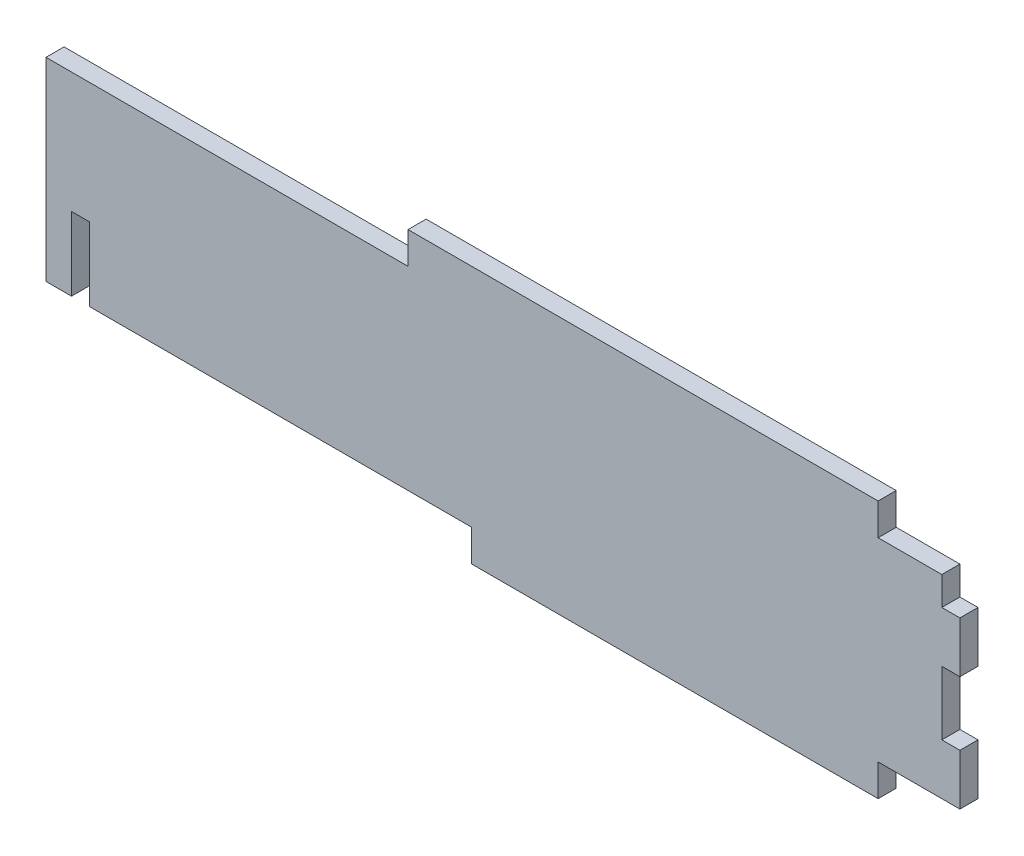
from build123d import *

# Parameters (mm, degrees)
BOSS_EXTRUDE1_DEPTH = 1.8034


with BuildPart() as part:
    # Sketch1 → Boss-Extrude1 (new body)
    with BuildSketch(Plane.XY):
        Polygon((-6.35, 1.5494), (-6.35, 4.7244), (1.8034, 4.7244), (1.8034, 9.8044), (0, 9.8044), (0, 16.1544), (1.8034, 16.1544), (1.8034, 21.2344), (0, 21.2344), (0, 24.0792), (-6.35, 24.0792), (-6.35, 27.2542), (-53.213, 27.2542), (-53.213, 24.0792), (-89.3064, 24.0792), (-89.3064, 4.7244), (-86.7664, 4.7244), (-86.7664, 12.0396), (-84.963, 12.0396), (-84.963, 4.7244), (-46.863, 4.7244), (-46.863, 1.5494), align=None)
    extrude(amount=BOSS_EXTRUDE1_DEPTH)


solid = part.part
